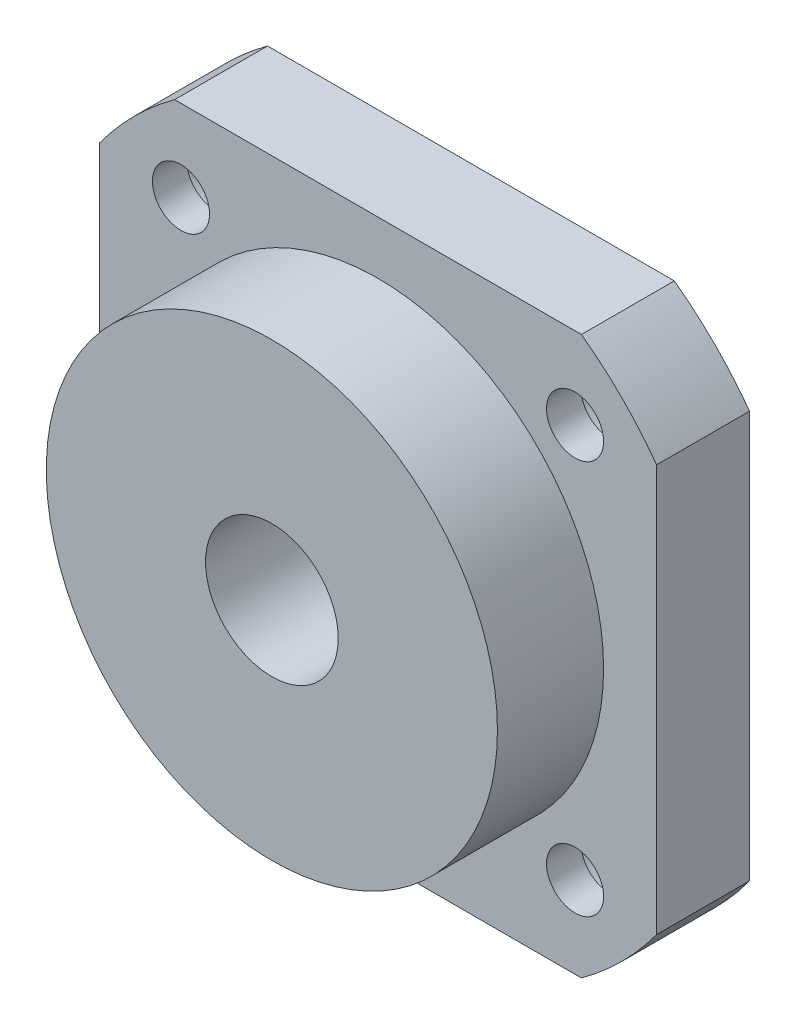
from build123d import *

# Parameters (mm, degrees)
SKETCH1_R                                           = 5
BOSS_EXTRUDE1_DEPTH                                 = 15
SKETCH2_R                                           = 27
SKETCH2_R_2                                         = 17
CUT_EXTRUDE_THIN1_DEPTH                             = 8
CBORE_FOR_M4_HEX_SOCKET_HEAD_CAP_SCREW1_D           = 4.3
CBORE_FOR_M4_HEX_SOCKET_HEAD_CAP_SCREW1_DEPTH       = 8.5
CBORE_FOR_M4_HEX_SOCKET_HEAD_CAP_SCREW1_CBORE_D     = 8
CBORE_FOR_M4_HEX_SOCKET_HEAD_CAP_SCREW1_CBORE_DEPTH = 4.4
CBORE_FOR_M4_HEX_SOCKET_HEAD_CAP_SCREW1_TIP         = 1.291850331
CBORE_FOR_M4_HEX_SOCKET_HEAD_CAP_SCREW2_D           = 4.3
CBORE_FOR_M4_HEX_SOCKET_HEAD_CAP_SCREW2_DEPTH       = 8.5
CBORE_FOR_M4_HEX_SOCKET_HEAD_CAP_SCREW2_CBORE_D     = 8
CBORE_FOR_M4_HEX_SOCKET_HEAD_CAP_SCREW2_CBORE_DEPTH = 4.4
CBORE_FOR_M4_HEX_SOCKET_HEAD_CAP_SCREW2_TIP         = 1.291850331
CBORE_FOR_M4_HEX_SOCKET_HEAD_CAP_SCREW3_D           = 4.3
CBORE_FOR_M4_HEX_SOCKET_HEAD_CAP_SCREW3_DEPTH       = 8.5
CBORE_FOR_M4_HEX_SOCKET_HEAD_CAP_SCREW3_CBORE_D     = 8
CBORE_FOR_M4_HEX_SOCKET_HEAD_CAP_SCREW3_CBORE_DEPTH = 4.4
CBORE_FOR_M4_HEX_SOCKET_HEAD_CAP_SCREW3_TIP         = 1.291850331
CBORE_FOR_M4_HEX_SOCKET_HEAD_CAP_SCREW4_D           = 4.3
CBORE_FOR_M4_HEX_SOCKET_HEAD_CAP_SCREW4_DEPTH       = 8.5
CBORE_FOR_M4_HEX_SOCKET_HEAD_CAP_SCREW4_CBORE_D     = 8
CBORE_FOR_M4_HEX_SOCKET_HEAD_CAP_SCREW4_CBORE_DEPTH = 4.4
CBORE_FOR_M4_HEX_SOCKET_HEAD_CAP_SCREW4_TIP         = 1.291850331


with BuildPart() as part:
    # Sketch1 → Boss-Extrude1 (new body)
    with BuildSketch(Plane.XY):
        with BuildLine():
            Line((15.329709717, -21), (-15.329709717, -21))
            ThreePointArc((-15.329709717, -21), (-18.384776311, -18.384776311), (-21, -15.329709717))
            Line((-21, -15.329709717), (-21, 15.329709717))
            ThreePointArc((-21, 15.329709717), (-18.384776311, 18.384776311), (-15.329709717, 21))
            Line((-15.329709717, 21), (15.329709717, 21))
            ThreePointArc((15.329709717, 21), (18.384776311, 18.384776311), (21, 15.329709717))
            Line((21, 15.329709717), (21, -15.329709717))
            ThreePointArc((21, -15.329709717), (18.384776311, -18.384776311), (15.329709717, -21))
        make_face()
        Circle(SKETCH1_R, mode=Mode.SUBTRACT)
    extrude(amount=BOSS_EXTRUDE1_DEPTH)

    # Sketch2 → Cut-Extrude-Thin1 (cut)
    with BuildSketch(Plane.XY.offset(15)):
        Circle(SKETCH2_R)
        Circle(SKETCH2_R_2, mode=Mode.SUBTRACT)
    extrude(amount=-CUT_EXTRUDE_THIN1_DEPTH, mode=Mode.SUBTRACT)

    # CBORE for M4 Hex Socket Head Cap Screw1
    with Locations(Plane(origin=(-14.849242405, 14.849242405, 0), x_dir=(-1, 0, 0), z_dir=(0, 0, -1))):
        with Locations((0, 0)):
            CounterBoreHole(CBORE_FOR_M4_HEX_SOCKET_HEAD_CAP_SCREW1_D / 2, CBORE_FOR_M4_HEX_SOCKET_HEAD_CAP_SCREW1_CBORE_D / 2, CBORE_FOR_M4_HEX_SOCKET_HEAD_CAP_SCREW1_CBORE_DEPTH, depth=CBORE_FOR_M4_HEX_SOCKET_HEAD_CAP_SCREW1_DEPTH)
            with Locations((0, 0, -(CBORE_FOR_M4_HEX_SOCKET_HEAD_CAP_SCREW1_DEPTH + CBORE_FOR_M4_HEX_SOCKET_HEAD_CAP_SCREW1_TIP / 2))):  # 118° drill point
                Cone(0, CBORE_FOR_M4_HEX_SOCKET_HEAD_CAP_SCREW1_D / 2, CBORE_FOR_M4_HEX_SOCKET_HEAD_CAP_SCREW1_TIP, mode=Mode.SUBTRACT)

    # CBORE for M4 Hex Socket Head Cap Screw2
    with Locations(Plane(origin=(14.849242405, 14.849242405, 0), x_dir=(-1, 0, 0), z_dir=(0, 0, -1))):
        with Locations((0, 0)):
            CounterBoreHole(CBORE_FOR_M4_HEX_SOCKET_HEAD_CAP_SCREW2_D / 2, CBORE_FOR_M4_HEX_SOCKET_HEAD_CAP_SCREW2_CBORE_D / 2, CBORE_FOR_M4_HEX_SOCKET_HEAD_CAP_SCREW2_CBORE_DEPTH, depth=CBORE_FOR_M4_HEX_SOCKET_HEAD_CAP_SCREW2_DEPTH)
            with Locations((0, 0, -(CBORE_FOR_M4_HEX_SOCKET_HEAD_CAP_SCREW2_DEPTH + CBORE_FOR_M4_HEX_SOCKET_HEAD_CAP_SCREW2_TIP / 2))):  # 118° drill point
                Cone(0, CBORE_FOR_M4_HEX_SOCKET_HEAD_CAP_SCREW2_D / 2, CBORE_FOR_M4_HEX_SOCKET_HEAD_CAP_SCREW2_TIP, mode=Mode.SUBTRACT)

    # CBORE for M4 Hex Socket Head Cap Screw3
    with Locations(Plane(origin=(14.849242405, -14.849242405, 0), x_dir=(-1, 0, 0), z_dir=(0, 0, -1))):
        with Locations((0, 0)):
            CounterBoreHole(CBORE_FOR_M4_HEX_SOCKET_HEAD_CAP_SCREW3_D / 2, CBORE_FOR_M4_HEX_SOCKET_HEAD_CAP_SCREW3_CBORE_D / 2, CBORE_FOR_M4_HEX_SOCKET_HEAD_CAP_SCREW3_CBORE_DEPTH, depth=CBORE_FOR_M4_HEX_SOCKET_HEAD_CAP_SCREW3_DEPTH)
            with Locations((0, 0, -(CBORE_FOR_M4_HEX_SOCKET_HEAD_CAP_SCREW3_DEPTH + CBORE_FOR_M4_HEX_SOCKET_HEAD_CAP_SCREW3_TIP / 2))):  # 118° drill point
                Cone(0, CBORE_FOR_M4_HEX_SOCKET_HEAD_CAP_SCREW3_D / 2, CBORE_FOR_M4_HEX_SOCKET_HEAD_CAP_SCREW3_TIP, mode=Mode.SUBTRACT)

    # CBORE for M4 Hex Socket Head Cap Screw4
    with Locations(Plane(origin=(-14.849242405, -14.849242405, 0), x_dir=(-1, 0, 0), z_dir=(0, 0, -1))):
        with Locations((0, 0)):
            CounterBoreHole(CBORE_FOR_M4_HEX_SOCKET_HEAD_CAP_SCREW4_D / 2, CBORE_FOR_M4_HEX_SOCKET_HEAD_CAP_SCREW4_CBORE_D / 2, CBORE_FOR_M4_HEX_SOCKET_HEAD_CAP_SCREW4_CBORE_DEPTH, depth=CBORE_FOR_M4_HEX_SOCKET_HEAD_CAP_SCREW4_DEPTH)
            with Locations((0, 0, -(CBORE_FOR_M4_HEX_SOCKET_HEAD_CAP_SCREW4_DEPTH + CBORE_FOR_M4_HEX_SOCKET_HEAD_CAP_SCREW4_TIP / 2))):  # 118° drill point
                Cone(0, CBORE_FOR_M4_HEX_SOCKET_HEAD_CAP_SCREW4_D / 2, CBORE_FOR_M4_HEX_SOCKET_HEAD_CAP_SCREW4_TIP, mode=Mode.SUBTRACT)


solid = part.part
